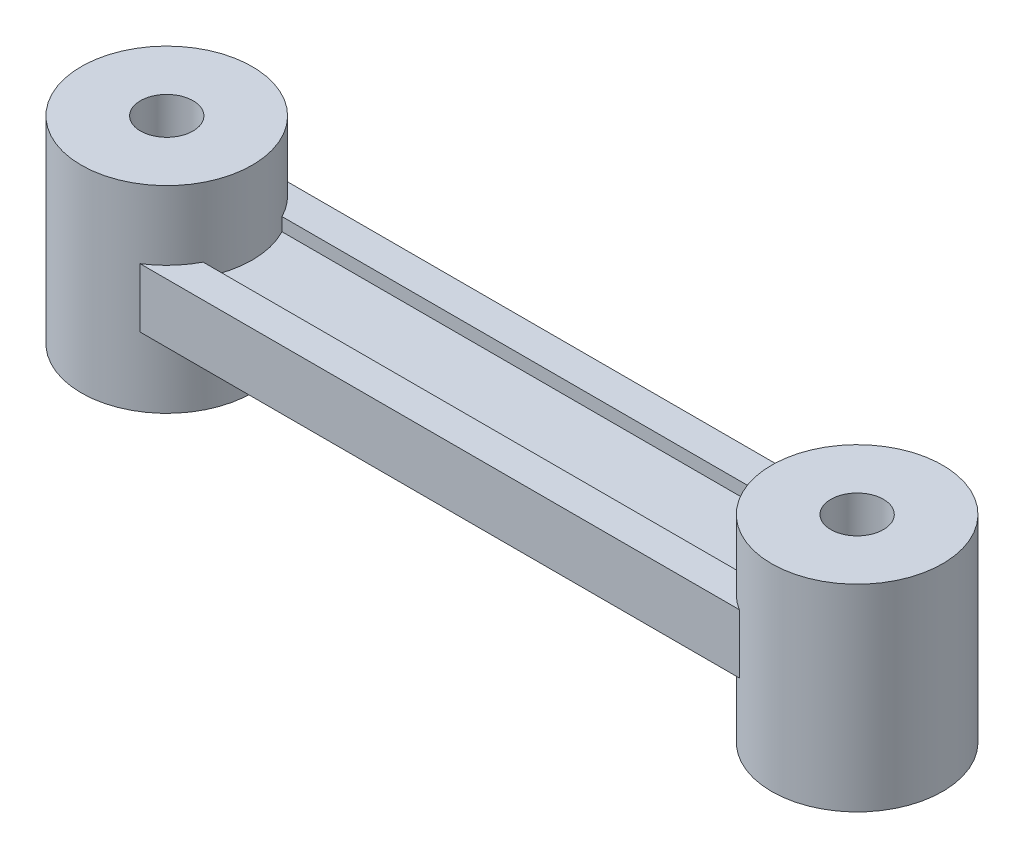
from build123d import *
from build123d.topology import SkipClean

# Parameters (mm, degrees)
SKETCH_1_R          = 13
SKETCH_1_R_2        = 4
EXTRUDE_1_DEPTH     = 15
EXTRUDE_1_2_DEPTH   = 15
EXTRUDE_2_DEPTH     = 4.5
CUT_EXTRUDE_1_DEPTH = 2


with BuildPart() as part:
    # Эскиз1 → Бобышка-Вытянуть1 (new, symmetric)
    with BuildSketch(Plane(origin=(0, 0, 0), x_dir=(1, 0, 0), z_dir=(0, 1, 0))):
        with Locations(Location((-118, 0, 0), (0, 0, 270))):
            Circle(SKETCH_1_R)
        with Locations(Location((-118, 0, 0), (0, 0, 270))):
            Circle(SKETCH_1_R_2, mode=Mode.SUBTRACT)
    extrude(amount=EXTRUDE_1_DEPTH, both=True)



with BuildPart() as body_2:
    # Эскиз1 → Extrude 1 2 (new, symmetric)
    with BuildSketch(Plane(origin=(0, 0, 0), x_dir=(1, 0, 0), z_dir=(0, 1, 0))):
        with Locations(Location((-13, 0, 0), (0, 0, 270))):
            Circle(SKETCH_1_R)
        with Locations(Location((-13, 0, 0), (0, 0, 270))):
            Circle(SKETCH_1_R_2, mode=Mode.SUBTRACT)
    extrude(amount=EXTRUDE_1_2_DEPTH, both=True)


with BuildPart() as part_1:
    add(part.part)

    add(body_2.part)  # Бобышка-Вытянуть2 merges body 2
    # Эскиз2 → Бобышка-Вытянуть2 (add, symmetric)
    with BuildSketch(Plane(origin=(0, 0, 0), x_dir=(1, 0, 0), z_dir=(0, 1, 0))):
        with BuildLine():
            Line((-111.07179677, 11), (-19.92820323, 11))
            ThreePointArc((-19.92820323, 11), (-26, 0), (-19.92820323, -11))
            Line((-19.92820323, -11), (-111.07179677, -11))
            ThreePointArc((-111.07179677, -11), (-105, 0), (-111.07179677, 11))
        make_face()
    extrude(amount=EXTRUDE_2_DEPTH, both=True)

    # Эскиз4 → Вырез-Вытянуть1 (cut)
    with SkipClean():  # the faces are left unmerged after this step: merging them gives an invalid solid
        with BuildSketch(Plane(origin=(0, 4.5, 0), x_dir=(1, 0, 0), z_dir=(0, 1, 0))):
            with BuildLine():
                Line((-106.467437405, 6), (-24.532562595, 6))
                ThreePointArc((-24.532562595, 6), (-26, 0), (-24.532562595, -6))
                Line((-24.532562595, -6), (-106.467437405, -6))
                ThreePointArc((-106.467437405, -6), (-105, 0), (-106.467437405, 6))
            make_face()
        cut_extrude_1 = extrude(amount=-CUT_EXTRUDE_1_DEPTH, mode=Mode.SUBTRACT)

    # Зеркальное отражение1: Вырез-Вытянуть1 across plane
    add(cut_extrude_1.mirror(Plane.ZX), mode=Mode.SUBTRACT)


solid = part_1.part
